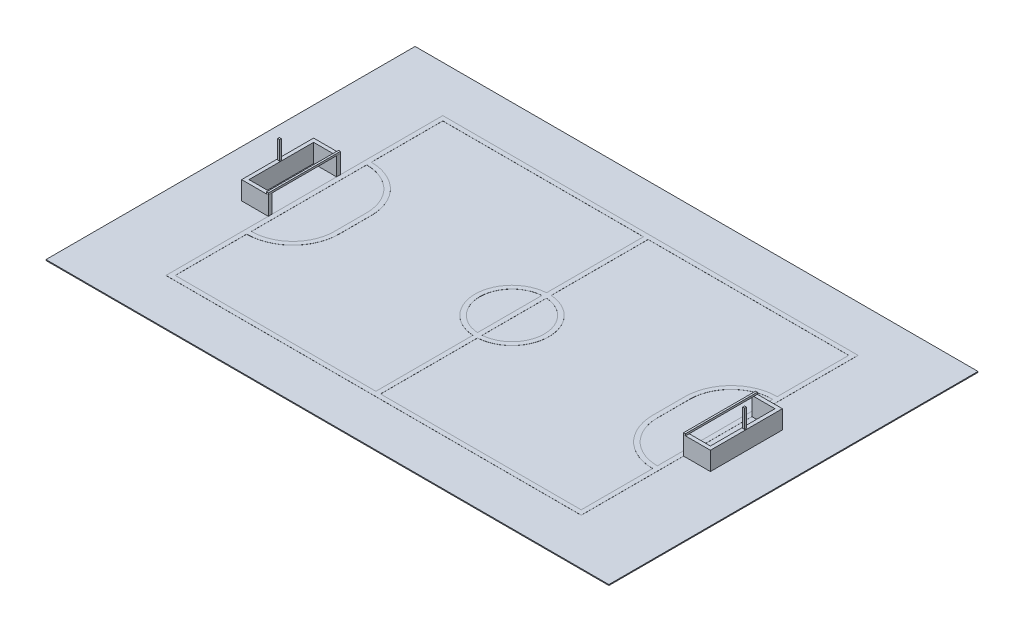
from build123d import *

# Parameters (mm, degrees)
SKETCH1_W              = 6100
SKETCH1_H              = 4000
BOSS_EXTRUDE1_DEPTH    = 10
SKETCH4_W              = 4500
SKETCH4_H              = 3000
BOSS_EXTRUDE3_DEPTH    = 1
BOSS_EXTRUDE4_DEPTH    = 200
BOSS_EXTRUDE8_DEPTH    = 200
SKETCH10_W             = 20
SKETCH10_H             = 20
BOSS_EXTRUDE9_DEPTH    = 200
BOSS_EXTRUDE9_2_DEPTH  = 200
SKETCH11_W             = 20
SKETCH11_H             = 20
BOSS_EXTRUDE10_DEPTH   = 780
BOSS_EXTRUDE10_2_DEPTH = 780


with BuildPart() as part:
    # Sketch1 → Boss-Extrude1 (new body)
    with BuildSketch(Plane(origin=(0, 0, 0), x_dir=(1, 0, 0), z_dir=(0, 1, 0))):
        with Locations((3050, 2000)):
            Rectangle(SKETCH1_W, SKETCH1_H)
    extrude(amount=BOSS_EXTRUDE1_DEPTH)

    # Sketch4 → Boss-Extrude3 (add)
    with BuildSketch(Plane(origin=(0, 10, 0), x_dir=(1, 0, 0), z_dir=(0, 1, 0))):
        with Locations((3050, 2000)):
            Rectangle(SKETCH4_W, SKETCH4_H)
        with BuildLine():
            Line((850, 2675), (850, 3450))
            Line((850, 3450), (3025, 3450))
            Line((3025, 3450), (3025, 2399.217985567))
            ThreePointArc((3025, 2399.217985567), (2650, 2000), (3025, 1600.782014433))
            Line((3025, 1600.782014433), (3025, 550))
            Line((3025, 550), (850, 550))
            Line((850, 550), (850, 1325))
            ThreePointArc((850, 1325), (1203.553390593, 1471.446609407), (1350, 1825))
            Line((1350, 1825), (1350, 2175))
            ThreePointArc((1350, 2175), (1203.553390593, 2528.553390593), (850, 2675))
        make_face(mode=Mode.SUBTRACT)
        with BuildLine():
            Line((3075, 2399.217985567), (3075, 3450))
            Line((3075, 3450), (5250, 3450))
            Line((5250, 3450), (5250, 2675))
            ThreePointArc((5250, 2675), (4896.446609407, 2528.553390593), (4750, 2175))
            Line((4750, 2175), (4750, 1825))
            ThreePointArc((4750, 1825), (4896.446609407, 1471.446609407), (5250, 1325))
            Line((5250, 1325), (5250, 550))
            Line((5250, 550), (3075, 550))
            Line((3075, 550), (3075, 1600.782014433))
            ThreePointArc((3075, 1600.782014433), (3450, 2000), (3075, 2399.217985567))
        make_face(mode=Mode.SUBTRACT)
        with BuildLine():
            Line((3025, 2349.106001094), (3025, 1650.893998906))
            ThreePointArc((3025, 1650.893998906), (2700, 2000), (3025, 2349.106001094))
        make_face(mode=Mode.SUBTRACT)
        with BuildLine():
            Line((3075, 2349.106001094), (3075, 1650.893998906))
            ThreePointArc((3075, 1650.893998906), (3400, 2000), (3075, 2349.106001094))
        make_face(mode=Mode.SUBTRACT)
        with BuildLine():
            Line((5250, 2625), (5250, 1375))
            ThreePointArc((5250, 1375), (4931.801948466, 1506.801948466), (4800, 1825))
            Line((4800, 1825), (4800, 2175))
            ThreePointArc((4800, 2175), (4931.801948466, 2493.198051534), (5250, 2625))
        make_face(mode=Mode.SUBTRACT)
        with BuildLine():
            Line((850, 2625), (850, 1375))
            ThreePointArc((850, 1375), (1168.198051534, 1506.801948466), (1300, 1825))
            Line((1300, 1825), (1300, 2175))
            ThreePointArc((1300, 2175), (1168.198051534, 2493.198051534), (850, 2625))
        make_face(mode=Mode.SUBTRACT)
    extrude(amount=BOSS_EXTRUDE3_DEPTH)

    # Sketch5 → Boss-Extrude4 (add)
    with BuildSketch(Plane(origin=(0, 10, 0), x_dir=(1, 0, 0), z_dir=(0, 1, 0))):
        Polygon((5300, 2390), (5590, 2390), (5590, 1610), (5300, 1610), (5300, 1650), (5550, 1650), (5550, 2350), (5300, 2350), align=None)
    extrude(amount=BOSS_EXTRUDE4_DEPTH)


with BuildPart() as body_2:
    # Sketch9 → Boss-Extrude8 (new body)
    with BuildSketch(Plane(origin=(0, 10, 0), x_dir=(1, 0, 0), z_dir=(0, 1, 0))):
        Polygon((800, 2390), (800, 2350), (550, 2350), (550, 1650), (800, 1650), (800, 1610), (510, 1610), (510, 2390), align=None)
    extrude(amount=BOSS_EXTRUDE8_DEPTH)


with BuildPart() as body_3:
    # Sketch10 → Boss-Extrude9 (new body)
    with BuildSketch(Plane(origin=(0, 210, 0), x_dir=(1, 0, 0), z_dir=(0, 1, 0))):
        with Locations((530, 2000)):
            Rectangle(SKETCH10_W, SKETCH10_H)
    extrude(amount=BOSS_EXTRUDE9_DEPTH)


with BuildPart() as body_4:
    # Sketch10 → Boss-Extrude9 2 (new body)
    with BuildSketch(Plane(origin=(0, 210, 0), x_dir=(1, 0, 0), z_dir=(0, 1, 0))):
        with Locations((5570, 2000)):
            Rectangle(SKETCH10_W, SKETCH10_H)
    extrude(amount=BOSS_EXTRUDE9_2_DEPTH)


with BuildPart() as body_5:
    # Sketch11 → Boss-Extrude10 (new body)
    with BuildSketch(Plane.XY.offset(-1610)):
        with Locations((790, 220)):
            Rectangle(SKETCH11_W, SKETCH11_H)
    extrude(amount=-BOSS_EXTRUDE10_DEPTH)


with BuildPart() as body_6:
    # Sketch11 → Boss-Extrude10 2 (new body)
    with BuildSketch(Plane.XY.offset(-1610)):
        with Locations((5310, 220)):
            Rectangle(SKETCH11_W, SKETCH11_H)
    extrude(amount=-BOSS_EXTRUDE10_2_DEPTH)


solid = Compound([part.part, body_2.part, body_3.part, body_4.part, body_5.part, body_6.part])
